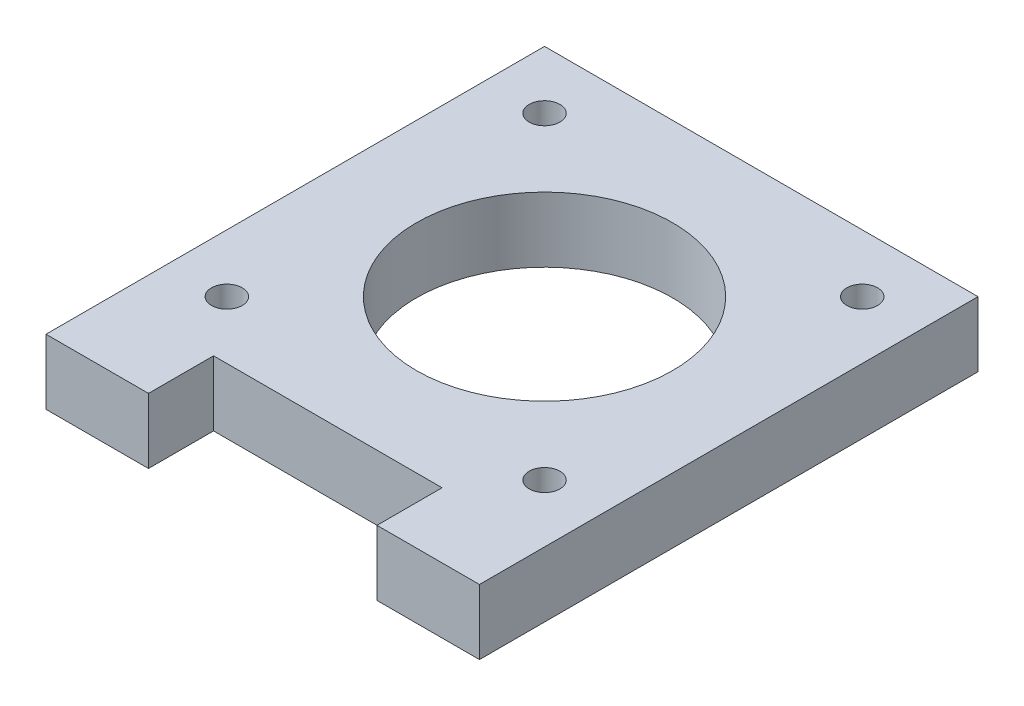
from build123d import *

# Parameters (mm, degrees)
SKETCH1_R           = 12.5
SKETCH1_R_2         = 1.5
BOSS_EXTRUDE1_DEPTH = 3.175


with BuildPart() as part:
    # Sketch1 → Boss-Extrude1 (new, symmetric)
    with BuildSketch(Plane(origin=(0, 0, 0), x_dir=(1, 0, 0), z_dir=(0, 1, 0))):
        Polygon((-21.15, -21.15), (-21.15, -27.5), (-11.15, -27.5), (-11.15, -21.15), (11.15, -21.15), (11.15, -27.5), (21.15, -27.5), (21.15, -21.15), (21.15, 21.15), (-21.15, 21.15), align=None)
        with Locations(Location((0, 0, 0), (0, 0, 270))):
            Circle(SKETCH1_R, mode=Mode.SUBTRACT)
        with Locations(Location((-15.5, 15.5, 0), (0, 0, 270))):
            Circle(SKETCH1_R_2, mode=Mode.SUBTRACT)
        with Locations(Location((15.5, 15.5, 0), (0, 0, 270))):
            Circle(SKETCH1_R_2, mode=Mode.SUBTRACT)
        with Locations(Location((15.5, -15.5, 0), (0, 0, 270))):
            Circle(SKETCH1_R_2, mode=Mode.SUBTRACT)
        with Locations(Location((-15.5, -15.5, 0), (0, 0, 270))):
            Circle(SKETCH1_R_2, mode=Mode.SUBTRACT)
    extrude(amount=BOSS_EXTRUDE1_DEPTH, both=True)


solid = part.part
